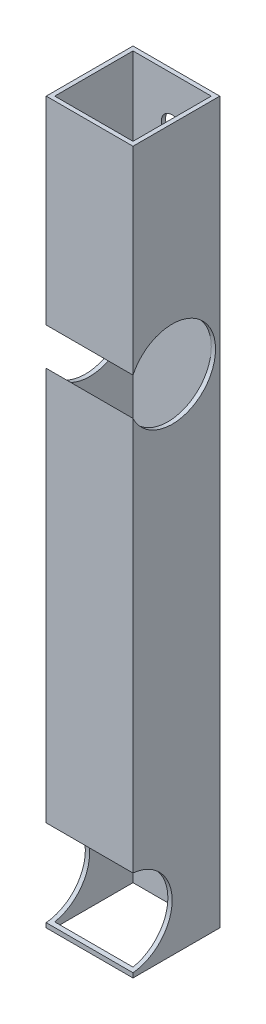
from build123d import *

# Parameters (mm, degrees)
SKETCH1_W           = 25.4
SKETCH1_H           = 25.4
SKETCH1_W_2         = 22.9108
SKETCH1_H_2         = 22.9108
BOSS_EXTRUDE1_DEPTH = 210.82
SKETCH2_R           = 12.7
CUT_EXTRUDE1_DEPTH  = 210.82
SKETCH3_R           = 3.175
CUT_EXTRUDE2_DEPTH  = 1.2446


with BuildPart() as part:
    # Sketch1 → Boss-Extrude1 (new body)
    with BuildSketch(Plane(origin=(0, 0, 0), x_dir=(1, 0, 0), z_dir=(0, 1, 0))):
        Rectangle(SKETCH1_W, SKETCH1_H)
        Rectangle(SKETCH1_W_2, SKETCH1_H_2, mode=Mode.SUBTRACT)
    extrude(amount=BOSS_EXTRUDE1_DEPTH)

    # Sketch2 → Cut-Extrude1 (cut)
    with BuildSketch(Plane(origin=(12.7, 0, 0), x_dir=(0, 0, -1), z_dir=(1, 0, 0))):
        with Locations((-1.2446, 147.32)):
            Circle(SKETCH2_R)
        with Locations((-13.9446, 13.97)):
            Circle(SKETCH2_R)
    extrude(amount=-CUT_EXTRUDE1_DEPTH, mode=Mode.SUBTRACT)

    # Sketch3 → Cut-Extrude2 (cut)
    with BuildSketch(Plane(origin=(0, 0, -12.7), x_dir=(-1, 0, 0), z_dir=(0, 0, -1))):
        with Locations((0, 197.1675)):
            Circle(SKETCH3_R)
        with Locations((0, 14.2875)):
            Circle(SKETCH3_R)
    extrude(amount=-CUT_EXTRUDE2_DEPTH, mode=Mode.SUBTRACT)


solid = part.part
